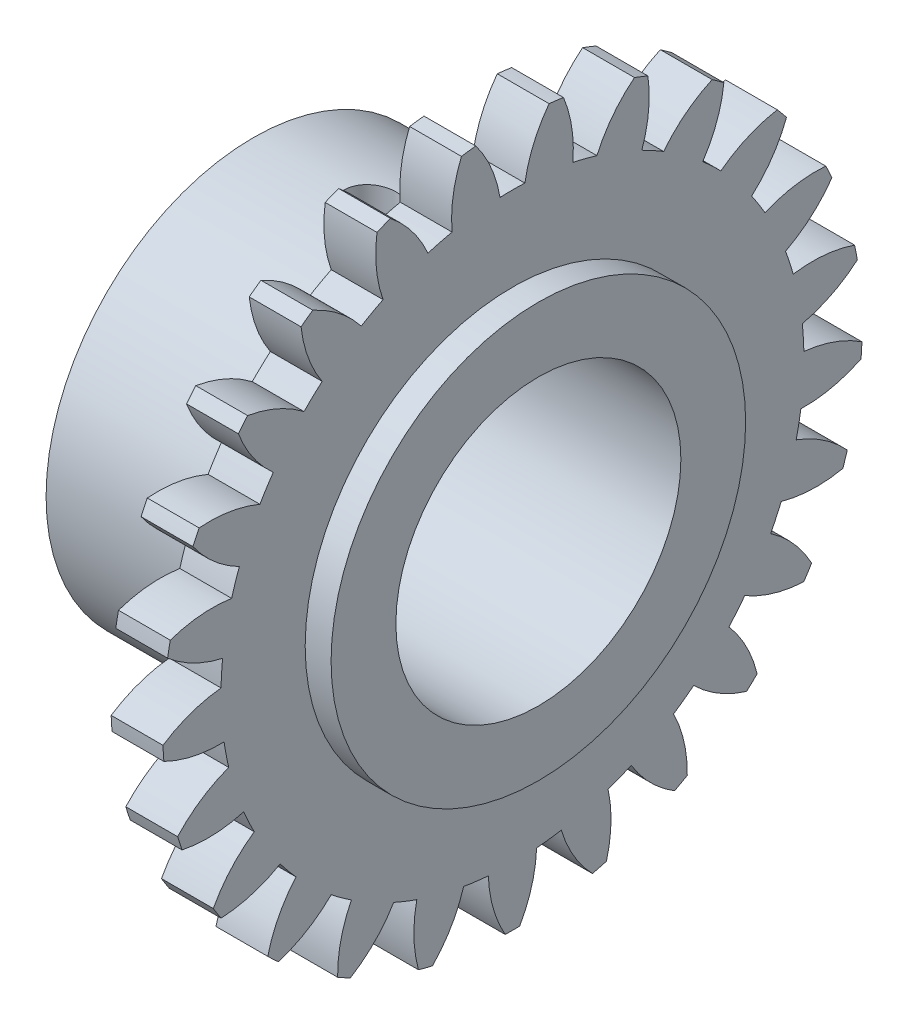
from build123d import *

# Parameters (mm, degrees)
BASPROSKE_W        = 2
BASPROSKE_H        = 13.5
TOOTHCUT_DEPTH     = 20.19635382
TEETHCUTS_COUNT    = 25
TEETHCUTS_ANGLE    = 345.6
BORSKE_R           = 5.5
BORE_DEPTH         = 50.0000508
BOSS_EXTRU_1_START = 1
ESQUISSE1_R        = 8
ESQUISSE1_R_2      = 5.5
BOSS_EXTRU_1_DEPTH = 1
ESQUISSE2_R        = 8
ESQUISSE2_R_2      = 5.5
BOSS_EXTRU_2_DEPTH = 8
ESQUISSE4_W        = 1
ESQUISSE4_H        = 13.425711508


with BuildPart() as part:
    # BasProSke → Base-Revolve (revolve)
    with BuildSketch(Plane(origin=(0, 0, 0), x_dir=(1, 0, 0), z_dir=(0, 1, 0)), mode=Mode.PRIVATE) as base_revolve_sk:
        with Locations((1, 6.75)):
            Rectangle(BASPROSKE_W, BASPROSKE_H)
    revolve(base_revolve_sk.sketch.rotate(Axis((-10, 0, 0), (1, 0, 0)), 180), axis=Axis((-10, 0, 0), (1, 0, 0)))

    # TooCutSke → ToothCut (cut, through all)
    with BuildSketch(Plane(origin=(0, 0, 0), x_dir=(0, 0, -1), z_dir=(1, 0, 0))):
        with BuildLine():
            ThreePointArc((0.480087995, 11.238750665), (0, 11.249), (-0.480087995, 11.238750665))
            ThreePointArc((-0.480087995, 11.238750665), (-0.821124963, 12.40220054), (-1.432168974, 13.449361962))
            ThreePointArc((-1.432168974, 13.449361962), (0, 13.5254), (1.432168974, 13.449361962))
            ThreePointArc((1.432168974, 13.449361962), (0.821124963, 12.40220054), (0.480087995, 11.238750665))
        make_face()
    toothcut = extrude(amount=TOOTHCUT_DEPTH, mode=Mode.SUBTRACT)

    # TeethCuts: ToothCut ×25 about axis
    teethcuts_axis = Axis((-10, 0, 0), (1, 0, 0))
    for i in range(1, TEETHCUTS_COUNT):
        add(toothcut.rotate(teethcuts_axis, i * TEETHCUTS_ANGLE / (TEETHCUTS_COUNT - 1)), mode=Mode.SUBTRACT)

    # BorSke → Bore (cut, symmetric)
    with BuildSketch(Plane(origin=(0, 0, 0), x_dir=(0, 0, -1), z_dir=(1, 0, 0))):
        with Locations(Location((0, 0, 0), (0, 0, 180))):
            Circle(BORSKE_R)
    extrude(amount=BORE_DEPTH, both=True, mode=Mode.SUBTRACT)

    # Esquisse1 → Boss.-Extru.1 (add)
    with BuildSketch(Plane(origin=(2, 0, 0), x_dir=(0, 0, -1), z_dir=(1, 0, 0)).offset(BOSS_EXTRU_1_START)):
        with Locations(Location((0, 0, 0), (0, 0, 180))):
            Circle(ESQUISSE1_R)
        Circle(ESQUISSE1_R_2, mode=Mode.SUBTRACT)
    extrude(amount=-BOSS_EXTRU_1_DEPTH)

    # Esquisse2 → Boss.-Extru.2 (add)
    with BuildSketch(Plane.ZY):
        Circle(ESQUISSE2_R)
        Circle(ESQUISSE2_R_2, mode=Mode.SUBTRACT)
    extrude(amount=BOSS_EXTRU_2_DEPTH)

    # Esquisse4 → Diamètre du perçage Ø2.0 (2)1 (revolve, cut)
    with BuildSketch(Plane(origin=(-3.5, 0, 0), x_dir=(0, 0, -1), z_dir=(1, 0, 0))):
        with Locations((0.5, 6.712855754)):
            Rectangle(ESQUISSE4_W, ESQUISSE4_H)
    revolve(axis=Axis((-3.5, -6.35, 0), (0, 1, 0)), mode=Mode.SUBTRACT)


solid = part.part
